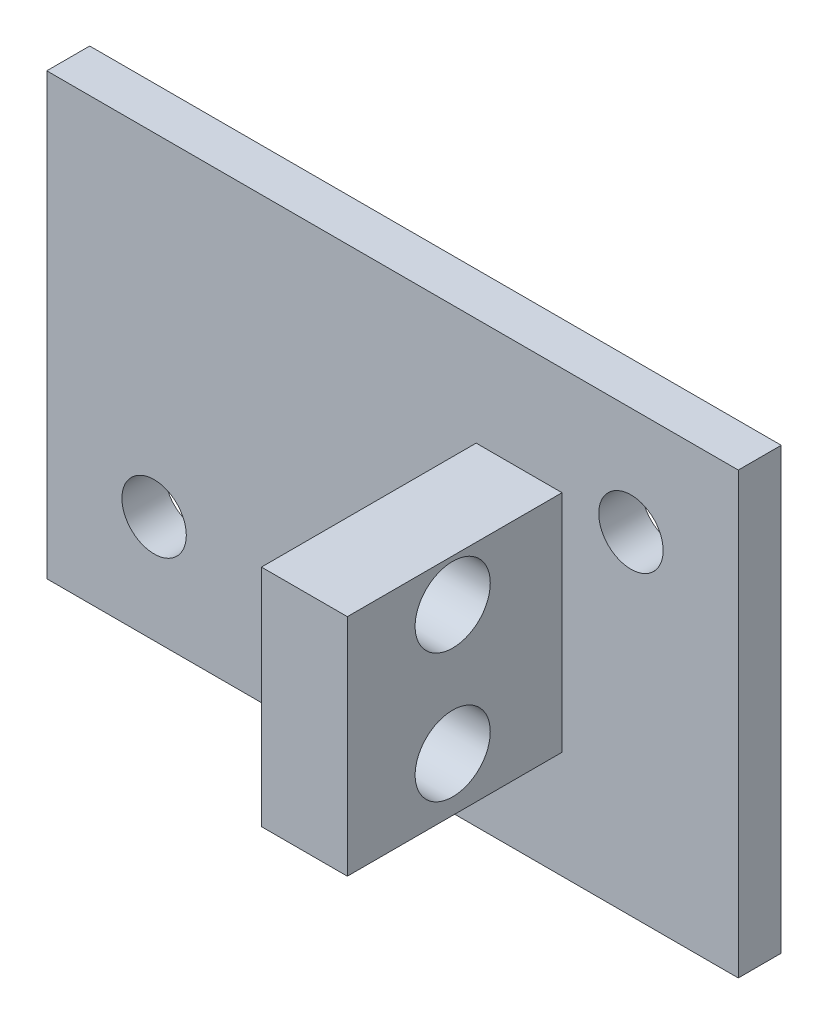
from build123d import *

# Parameters (mm, degrees)
ESQUISSE1_W             = 32.21
ESQUISSE1_H             = 20.49
ESQUISSE1_R             = 1.5
BOSS_EXTRU_1_DEPTH      = 2
ESQUISSE2_W             = 4
ESQUISSE2_H             = 10.471151719
BOSS_EXTRU_2_DEPTH      = 10
ESQUISSE3_R             = 1.75
ENL_V_MAT_EXTRU_1_DEPTH = 10


with BuildPart() as part:
    # Esquisse1 → Boss.-Extru.1 (new body)
    with BuildSketch(Plane.XY):
        with Locations((16.105, 10.245)):
            Rectangle(ESQUISSE1_W, ESQUISSE1_H)
        with Locations((27.21, 15.49)):
            Circle(ESQUISSE1_R, mode=Mode.SUBTRACT)
        with Locations((5, 5)):
            Circle(ESQUISSE1_R, mode=Mode.SUBTRACT)
    extrude(amount=BOSS_EXTRU_1_DEPTH)

    # Esquisse2 → Boss.-Extru.2 (add)
    with BuildSketch(Plane.XY.offset(2)):
        with Locations((22, 10.23557586)):
            Rectangle(ESQUISSE2_W, ESQUISSE2_H)
    extrude(amount=BOSS_EXTRU_2_DEPTH)

    # Esquisse3 → Enlèv. mat.-Extru.1 (cut)
    with BuildSketch(Plane(origin=(24, 0, 0), x_dir=(0, 0, -1), z_dir=(1, 0, 0))):
        with Locations((-7.092486799, 13.5)):
            Circle(ESQUISSE3_R)
        with Locations((-7.092486799, 7.5)):
            Circle(ESQUISSE3_R)
    extrude(amount=-ENL_V_MAT_EXTRU_1_DEPTH, mode=Mode.SUBTRACT)


solid = part.part
